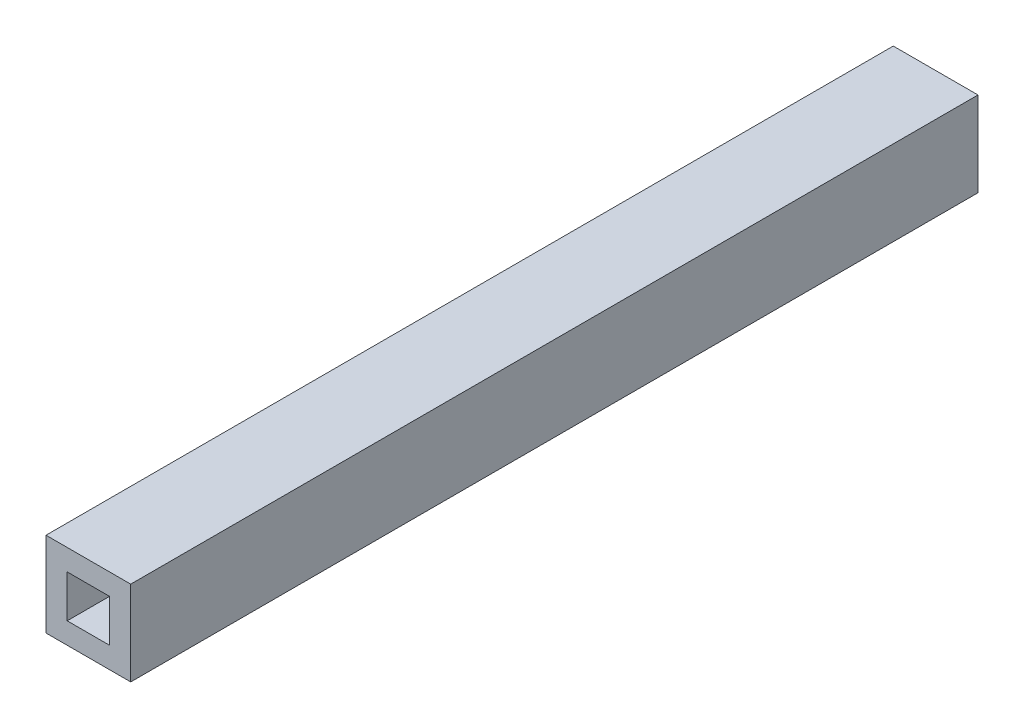
from build123d import *

# Parameters (mm, degrees)
SKETCH1_W           = 20
SKETCH1_H           = 20
SKETCH1_W_2         = 10
SKETCH1_H_2         = 10
EXTRUDE_THIN1_DEPTH = 200


with BuildPart() as part:
    # Sketch1 → Extrude-Thin1 (new body)
    with BuildSketch(Plane.XY):
        Rectangle(SKETCH1_W, SKETCH1_H)
        Rectangle(SKETCH1_W_2, SKETCH1_H_2, mode=Mode.SUBTRACT)
    extrude(amount=EXTRUDE_THIN1_DEPTH)


solid = part.part
